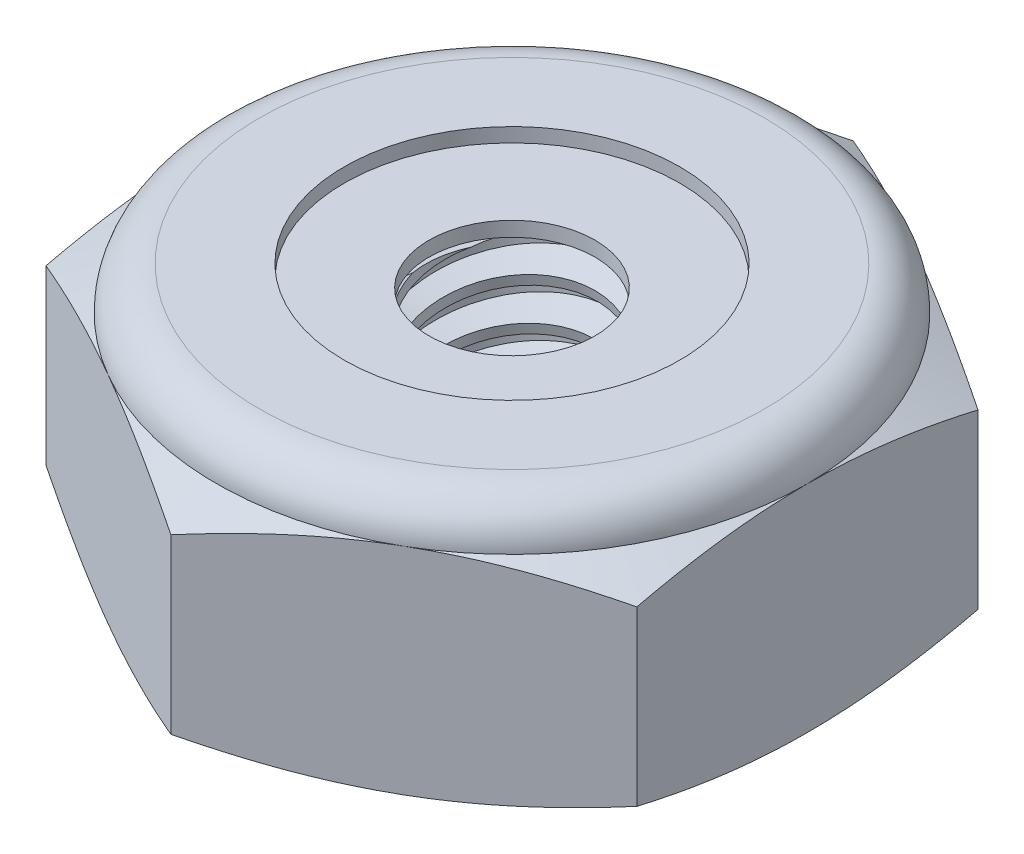
from build123d import *

# Parameters (mm, degrees)
EXTRUDE1_DEPTH       = 2.778125
SKETCH2_W            = 1.0922
SKETCH2_H            = 2.778125
LPATTERN1_COUNT      = 6
LPATTERN1_PITCH      = 0.453571429
LPATTERN1_COUNT_DIR2 = 2
LPATTERN1_PITCH_DIR2 = 0.453571429


with BuildPart() as part:
    # Sketch1 → Extrude1 (new body)
    with BuildSketch(Plane(origin=(0, 0, 0), x_dir=(1, 0, 0), z_dir=(0, 1, 0))):
        Polygon((0, 3.666174209), (-3.175, 1.833087105), (-3.175, -1.833087105), (0, -3.666174209), (3.175, -1.833087105), (3.175, 1.833087105), align=None)
    extrude(amount=EXTRUDE1_DEPTH)

    # Sketch4 → Cut-Revolve2 (revolve, cut)
    with BuildSketch(Plane(origin=(0, 0, 0), x_dir=(0, 0, -1), z_dir=(1, 0, 0))):
        Polygon((0, 2.778125), (1.0922, 2.778125), (0.892167741, 2.684848426), (0.892167741, 0.093276574), (1.0922, 0), (0, 0), align=None)
    revolve(axis=Axis((0, 2.778125, 0), (0, 1, 0)), mode=Mode.SUBTRACT)


with BuildPart() as body_2:
    # Sketch2 → Revolve1 (revolve)
    with BuildSketch(Plane(origin=(0, 0, 0), x_dir=(0, 0, -1), z_dir=(1, 0, 0))):
        with Locations((0.5461, 1.3890625)):
            Rectangle(SKETCH2_W, SKETCH2_H)
    revolve(axis=Axis((0, -1.0922, 0), (0, 1, 0)))

    # Sketch3 → Cut-Revolve1 (revolve, cut)
    with BuildSketch(Plane(origin=(0, 0, 0), x_dir=(0, 0, -1), z_dir=(1, 0, 0))):
        Polygon((1.103726651, 2.722612647), (1.184413211, 2.334026177), (0.915221043, 2.422895195), (0.892167741, 2.533919901), align=None)
    cut_revolve1 = revolve(axis=Axis((0, 2.778125, 0.101196353), (0, -0.9791155152480938, -0.2033047166212823)), mode=Mode.SUBTRACT)

    # LPattern1: Cut-Revolve1 6 × 2
    with Locations(*[Vector(0, -1, 0) * (i * LPATTERN1_PITCH) + Vector(0, 1, 0) * (j * LPATTERN1_PITCH_DIR2) for i in range(LPATTERN1_COUNT) for j in range(LPATTERN1_COUNT_DIR2) if (i, j) != (0, 0)]):
        add(cut_revolve1, mode=Mode.SUBTRACT)


with BuildPart() as part_1:
    add(part.part)

    # Combine1: cut body 2
    add(body_2.part, mode=Mode.SUBTRACT)

    # Sketch5 → Cut-Revolve3 (revolve, cut)
    with BuildSketch(Plane(origin=(0, 0, 0), x_dir=(0, 0, -1), z_dir=(1, 0, 0))):
        with BuildLine():
            Line((0, 0), (3.175, 0))
            Line((3.175, 0), (3.666174209, 0.229038295))
            Line((3.666174209, 0.229038295), (3.666174209, 2.086065871))
            Line((3.666174209, 2.086065871), (3.175, 2.315104167))
            ThreePointArc((3.175, 2.315104167), (3.039384338, 2.642509338), (2.711979167, 2.778125))
            Line((2.711979167, 2.778125), (2.711979167, 4.048125))
            Line((2.711979167, 4.048125), (4.936174209, 4.048125))
            Line((4.936174209, 4.048125), (4.936174209, -1.27))
            Line((4.936174209, -1.27), (0, -1.27))
            Line((0, -1.27), (0, 0))
        make_face()
    revolve(axis=Axis((0, 0, 0), (0, 1, 0)), mode=Mode.SUBTRACT)

    # Sketch6 → Cut-Revolve4 (revolve, cut)
    with BuildSketch(Plane(origin=(0, 0, 0), x_dir=(0, 0, -1), z_dir=(1, 0, 0))):
        with BuildLine():
            Line((0, 2.315104167), (3.0226, 2.315104167))
            ThreePointArc((3.0226, 2.315104167), (2.931621264, 2.534746264), (2.711979167, 2.625725))
            Line((2.711979167, 2.625725), (1.802073454, 2.625725))
            Line((1.802073454, 2.625725), (1.802073454, 4.048125))
            Line((1.802073454, 4.048125), (0, 4.048125))
            Line((0, 4.048125), (0, 2.315104167))
        make_face()
    revolve(axis=Axis((0, 4.048125, 0), (0, 1, 0)), mode=Mode.SUBTRACT)


with BuildPart() as body_2_2:
    # Sketch7 → Revolve2 (revolve)
    with BuildSketch(Plane(origin=(0, 0, 0), x_dir=(0, 0, -1), z_dir=(1, 0, 0))):
        with BuildLine():
            Line((0.892167741, 2.391304167), (2.933669688, 2.391304167))
            ThreePointArc((2.933669688, 2.391304167), (2.848159671, 2.505912964), (2.711979167, 2.549525))
            Line((2.711979167, 2.549525), (0.892167741, 2.549525))
            Line((0.892167741, 2.549525), (0.892167741, 2.391304167))
        make_face()
    revolve(axis=Axis((0, 2.391304167, 0), (0, 1, 0)))


solid = Compound([part_1.part, body_2_2.part])
